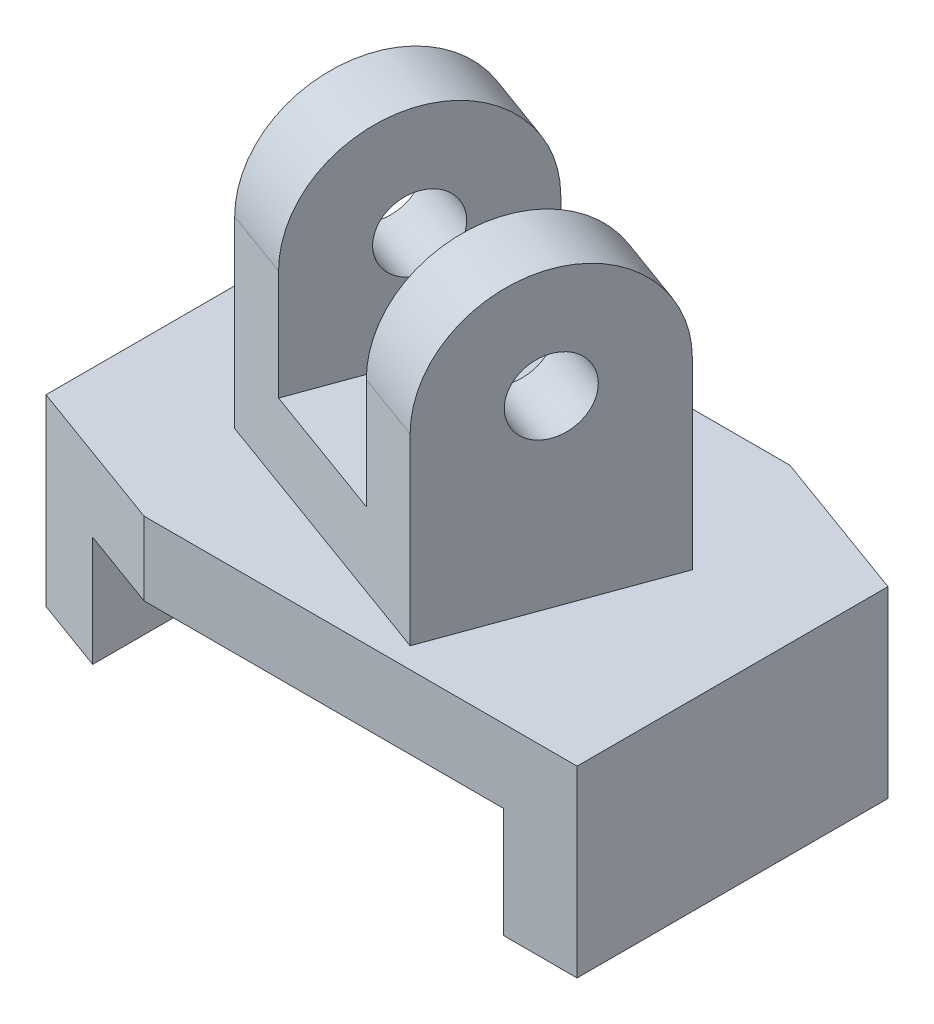
from build123d import *

# Parameters (mm, degrees)
EXTRUDE_1_DEPTH     = 25
SKETCH_2_W          = 60
SKETCH_2_H          = 15
CUT_EXTRUDE_1_DEPTH = 69.738635424
EXTRUDE_2_DEPTH     = 40
SKETCH_4_R          = 5
CUT_EXTRUDE_2_DEPTH = 79.882076454
SKETCH_5_W          = 20
SKETCH_5_H          = 30
CUT_EXTRUDE_3_DEPTH = 40


with BuildPart() as part:
    # Эскиз1 → Бобышка-Вытянуть1 (new body)
    with BuildSketch(Plane(origin=(0, 0, 0), x_dir=(1, 0, 0), z_dir=(0, 1, 0))):
        Polygon((-40, 25), (19, 25), (40, 17.35662508), (40, -25), (-19, -25), (-40, -17.35662508), align=None)
    extrude(amount=-EXTRUDE_1_DEPTH)

    # Эскиз2 → Вырез-Вытянуть1 (cut, through all)
    with BuildSketch(Plane.XY.offset(25)):
        with Locations((0, -17.5)):
            Rectangle(SKETCH_2_W, SKETCH_2_H)
    extrude(amount=-CUT_EXTRUDE_1_DEPTH, mode=Mode.SUBTRACT)

    # Эскиз3 → Бобышка-Вытянуть2 (add)
    with BuildSketch(Plane(origin=(0, 0, 0), x_dir=(1, 0, 0), z_dir=(0, 1, 0))):
        Polygon((-12.902085739, 19.7), (24.685619092, 6.019194267), (14.425014792, -22.171584357), (-23.162690039, -8.490778624), align=None)
    extrude(amount=EXTRUDE_2_DEPTH)

    # Эскиз4 → Вырез-Вытянуть2 (cut, through all)
    with BuildSketch(Plane(origin=(19.863418464, 0, 7.229693072), x_dir=(0.34202014332567277, 0, -0.939692620785907), z_dir=(0.939692620785907, 0, 0.34202014332567277))):
        with BuildLine():
            Line((-15.900828584, 40), (-15.900828584, 25))
            ThreePointArc((-15.900828584, 25), (-11.507430302, 35.606601718), (-0.900828584, 40))
            Line((-0.900828584, 40), (-15.900828584, 40))
        make_face()
        with BuildLine():
            Line((14.099171416, 40), (-0.900828584, 40))
            ThreePointArc((-0.900828584, 40), (9.705773134, 35.606601718), (14.099171416, 25))
            Line((14.099171416, 25), (14.099171416, 40))
        make_face()
        with Locations((-0.900828584, 25)):
            Circle(SKETCH_4_R)
    extrude(amount=-CUT_EXTRUDE_2_DEPTH, mode=Mode.SUBTRACT)

    # Эскиз5 → Вырез-Вытянуть3 (cut)
    with BuildSketch(Plane(origin=(-5.438403671, 0, 14.941891285), x_dir=(0.9396926207859105, 0, 0.34202014332566305), z_dir=(-0.34202014332566305, 0, 0.9396926207859105))):
        with Locations((1.138208415, 25)):
            Rectangle(SKETCH_5_W, SKETCH_5_H)
    extrude(amount=-CUT_EXTRUDE_3_DEPTH, mode=Mode.SUBTRACT)


solid = part.part
